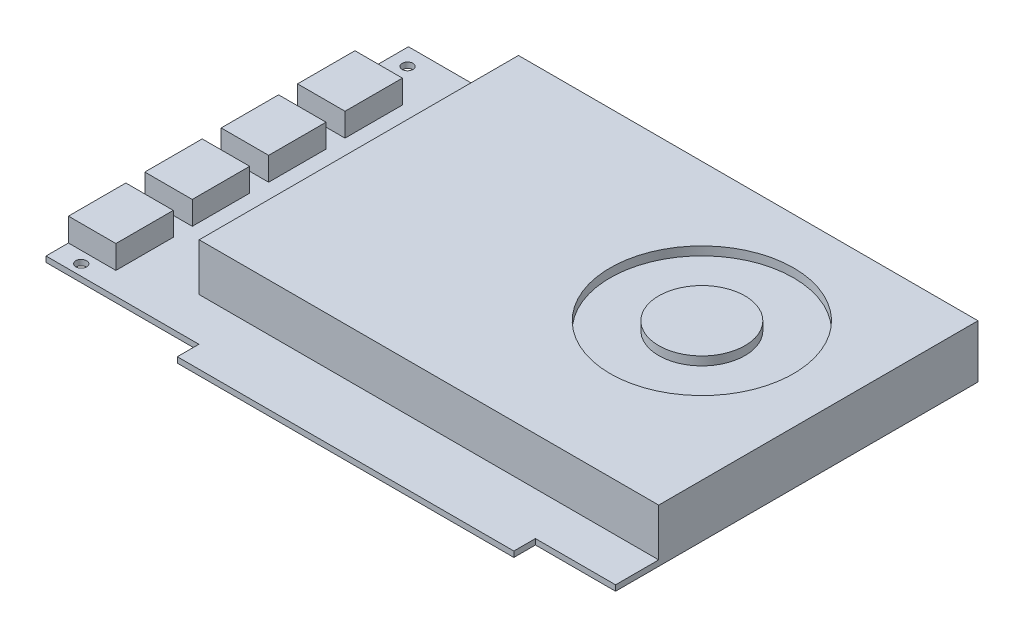
from build123d import *

# Parameters (mm, degrees)
SKETCH1_W             = 167.64
SKETCH1_H             = 106.68
SKETCH1_W_2           = 99.06
SKETCH1_H_2           = 6.35
BOSS_EXTRUDE1_DEPTH   = 1.651
SKETCH2_W             = 135.255
SKETCH2_H             = 93.98
BOSS_EXTRUDE2_DEPTH   = 13.97
F_4_CLEARANCE_HOLE1_D = 3.175
SKETCH6_W             = 13.97
SKETCH6_H             = 16.891
BOSS_EXTRUDE3_DEPTH   = 6.858
SKETCH7_W             = 2.54
SKETCH7_H             = 12.7
CUT_EXTRUDE5_DEPTH    = 2.54
LPATTERN1_COUNT       = 18
LPATTERN1_PITCH       = 5.08
SKETCH8_R             = 26.9875
SKETCH8_R_2           = 12.7
CUT_EXTRUDE6_DEPTH    = 2.54


with BuildPart() as part:
    # Sketch1 → Boss-Extrude1 (new body)
    with BuildSketch(Plane(origin=(0, 0, 0), x_dir=(1, 0, 0), z_dir=(0, 1, 0))):
        Rectangle(SKETCH1_W, SKETCH1_H)
        with Locations((10.71, -56.515)):
            Rectangle(SKETCH1_W_2, SKETCH1_H_2)
    extrude(amount=BOSS_EXTRUDE1_DEPTH)

    # Sketch2 → Boss-Extrude2 (add)
    with BuildSketch(Plane(origin=(0, 1.651, 0), x_dir=(1, 0, 0), z_dir=(0, 1, 0))):
        with Locations((16.1925, 6.35)):
            Rectangle(SKETCH2_W, SKETCH2_H)
    extrude(amount=BOSS_EXTRUDE2_DEPTH)

    # #4 Clearance Hole1 (through all)
    with Locations(Plane(origin=(-78.9305, 1.651, -48.1965), x_dir=(0, 0, 1), z_dir=(0, 1, 0))):
        with Locations((0, 0), (98.3488, 2.286)):
            Hole(F_4_CLEARANCE_HOLE1_D / 2)

    # Sketch6 → Boss-Extrude3 (add)
    with BuildSketch(Plane(origin=(0, 1.651, 0), x_dir=(1, 0, 0), z_dir=(0, 1, 0))):
        with Locations((-76.835, 29.1465)):
            Rectangle(SKETCH6_W, SKETCH6_H)
        with Locations((-76.835, 6.6675)):
            Rectangle(SKETCH6_W, SKETCH6_H)
        with Locations((-76.835, -15.8115)):
            Rectangle(SKETCH6_W, SKETCH6_H)
        with Locations((-76.835, -38.2905)):
            Rectangle(SKETCH6_W, SKETCH6_H)
    extrude(amount=BOSS_EXTRUDE3_DEPTH)

    # Sketch7 → Cut-Extrude5 (cut)
    with BuildSketch(Plane.ZY.offset(51.435)):
        with Locations((36.83, 8.636)):
            Rectangle(SKETCH7_W, SKETCH7_H)
    cut_extrude5 = extrude(amount=-CUT_EXTRUDE5_DEPTH, mode=Mode.SUBTRACT)

    # LPattern1: Cut-Extrude5 ×18
    with Locations(*[(0, 0, -i * LPATTERN1_PITCH) for i in range(1, LPATTERN1_COUNT)]):
        add(cut_extrude5, mode=Mode.SUBTRACT)

    # Sketch8 → Cut-Extrude6 (cut)
    with BuildSketch(Plane(origin=(0, 15.621, 0), x_dir=(1, 0, 0), z_dir=(0, 1, 0))):
        with Locations(Location((43.18, 12.7, 0), (0, 0, 270))):
            Circle(SKETCH8_R)
        with Locations(Location((43.18, 12.7, 0), (0, 0, 270))):
            Circle(SKETCH8_R_2, mode=Mode.SUBTRACT)
    extrude(amount=-CUT_EXTRUDE6_DEPTH, mode=Mode.SUBTRACT)


solid = part.part
